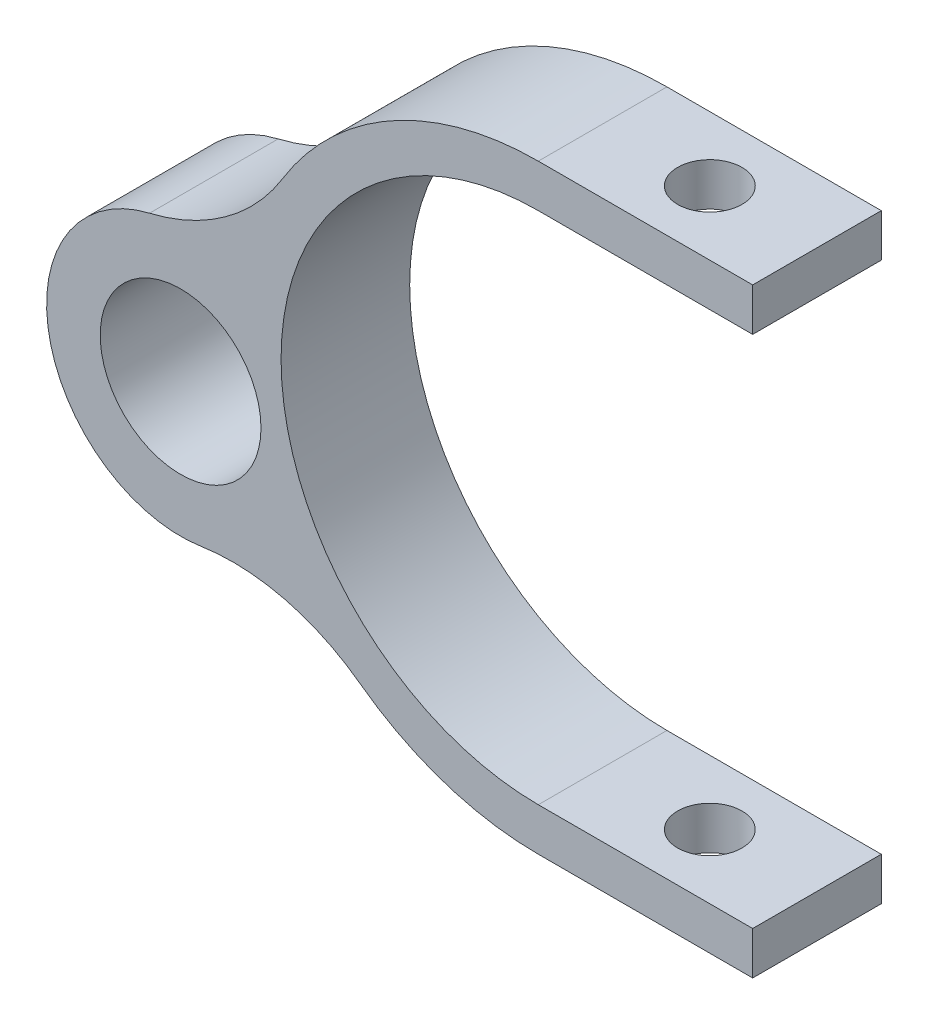
from build123d import *

# Parameters (mm, degrees)
SKETCH1_R           = 3.75
BOSS_EXTRUDE1_DEPTH = 6
SKETCH2_R           = 1.5
CUT_EXTRUDE1_DEPTH  = 39
FILLET1_R           = 10


with BuildPart() as part:
    # Sketch1 → Boss-Extrude1 (new body)
    with BuildSketch(Plane.XY):
        with BuildLine():
            Line((0, 12), (10, 12))
            Line((10, 12), (10, 14))
            Line((10, 14), (0, 14))
            ThreePointArc((0, 14), (-9.050345568, 10.681350341), (-13.809987388, 2.2987493))
            ThreePointArc((-13.809987388, 2.2987493), (-22.82117325, -4.444834248), (-11.937810072, -7.313596289))
            ThreePointArc((-11.937810072, -7.313596289), (-6.841405263, -12.214547639), (0, -14))
            Line((0, -14), (10, -14))
            Line((10, -14), (10, -12))
            Line((10, -12), (0, -12))
            ThreePointArc((0, -12), (-12, 0), (0, 12))
        make_face()
        with Locations((-16.686449258, -3.249986332)):
            Circle(SKETCH1_R, mode=Mode.SUBTRACT)
    extrude(amount=BOSS_EXTRUDE1_DEPTH)

    # Sketch2 → Cut-Extrude1 (cut)
    with BuildSketch(Plane(origin=(0, 14, 0), x_dir=(1, 0, 0), z_dir=(0, 1, 0))):
        with Locations(Location((5, -3, 0), (0, 0, 180))):
            Circle(SKETCH2_R)
    extrude(amount=-CUT_EXTRUDE1_DEPTH, mode=Mode.SUBTRACT)

    # Fillet1
    fillet1_edges = [part.edges().sort_by_distance(p)[0] for p in [
        (-11.937810072, -7.313596289, 3),
        (-13.809987388, 2.2987493, 3),
    ]]
    fillet(fillet1_edges, radius=FILLET1_R)


solid = part.part
